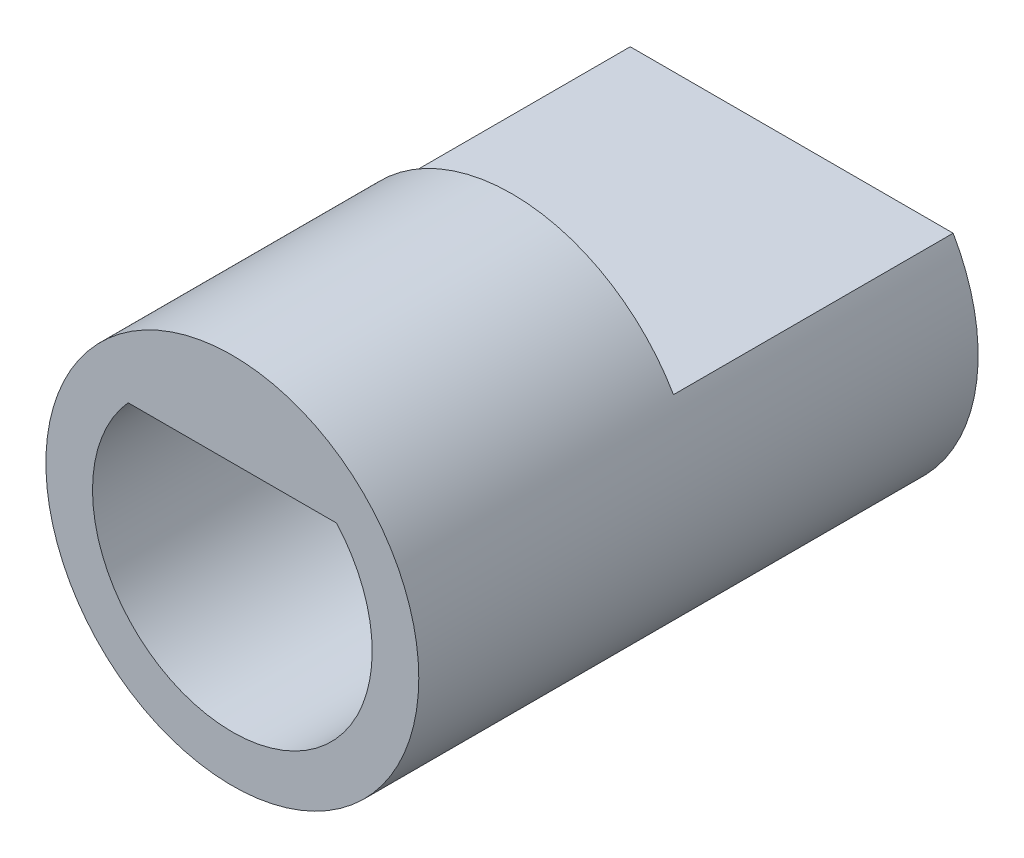
from build123d import *
from build123d.topology import SkipClean

# Parameters (mm, degrees)
SKETCH1_R      = 2
EXTRUDE1_DEPTH = 3
EXTRUDE2_START = 3
EXTRUDE2_DEPTH = 3
EXTRUDE3_DEPTH = 2.5


with BuildPart() as part:
    # Sketch1 → Extrude1 (new body)
    with BuildSketch(Plane.XY):
        Circle(SKETCH1_R)
    extrude(amount=EXTRUDE1_DEPTH)

    # Sketch2 → Extrude2 (add)
    with SkipClean():  # the faces are left unmerged after this step: merging them gives an invalid solid
        with BuildSketch(Plane(origin=(0, 0, 0), x_dir=(-1, 0, 0), z_dir=(0, 0, -1)).offset(EXTRUDE2_START)):
            with BuildLine():
                ThreePointArc((-1.732050808, 1), (-1.732050808, -1), (0, -2))
                Line((0, -2), (0, 1))
                Line((0, 1), (-1.732050808, 1))
            make_face()
            with BuildLine():
                Line((0, 1), (0, -2))
                ThreePointArc((0, -2), (1.732050808, -1), (1.732050808, 1))
                Line((1.732050808, 1), (0, 1))
            make_face()
        extrude(amount=-EXTRUDE2_DEPTH)

    # Sketch3 → Extrude3 (cut)
    with SkipClean():  # the faces are left unmerged after this step: merging them gives an invalid solid
        with BuildSketch(Plane.XY.offset(3)):
            with BuildLine():
                ThreePointArc((-1.118033989, 1), (-1.369306394, -0.612372436), (0, -1.5))
                Line((0, -1.5), (0, 1))
                Line((0, 1), (-1.118033989, 1))
            make_face()
            with BuildLine():
                Line((0, 1), (0, -1.5))
                ThreePointArc((0, -1.5), (1.060660172, -1.060660172), (1.5, 0))
                ThreePointArc((1.5, 0), (1.401258538, 0.535233135), (1.118033989, 1))
                Line((1.118033989, 1), (0, 1))
            make_face()
        extrude(amount=-EXTRUDE3_DEPTH, mode=Mode.SUBTRACT)


solid = part.part
